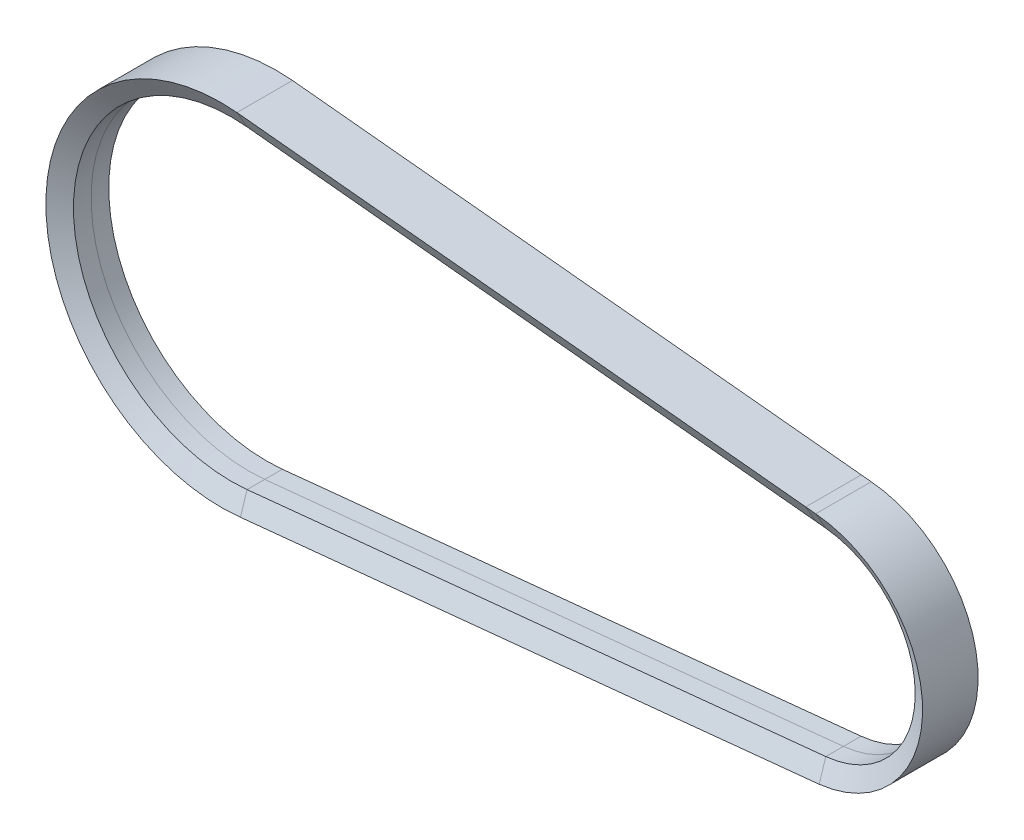
from build123d import *


with BuildPart() as part:
    # Sweep1: sweep along a path in Sketch2
    with BuildLine(Plane.XY) as sweep1_path:
        Line((3.4, -33.829572862), (-194.6, -53.729321604))
        ThreePointArc((-194.6, -53.729321604), (-254, 0), (-194.6, 53.729321604))
        Line((-194.6, 53.729321604), (3.4, 33.829572862))
        ThreePointArc((3.4, 33.829572862), (34, 0), (3.4, -33.829572862))
    # Sketch4 → Sweep1 (sweep)
    with BuildSketch(Plane(origin=(0, 0, 0), x_dir=(0, 0, -1), z_dir=(1, 0, 0))):
        Polygon((0, 34.171285719), (6.035, 34.171285719), (9.499101615, 40.171285719), (-9.499101615, 40.171285719), (-6.035, 34.171285719), align=None)
    sweep(path=sweep1_path.line)


solid = part.part
